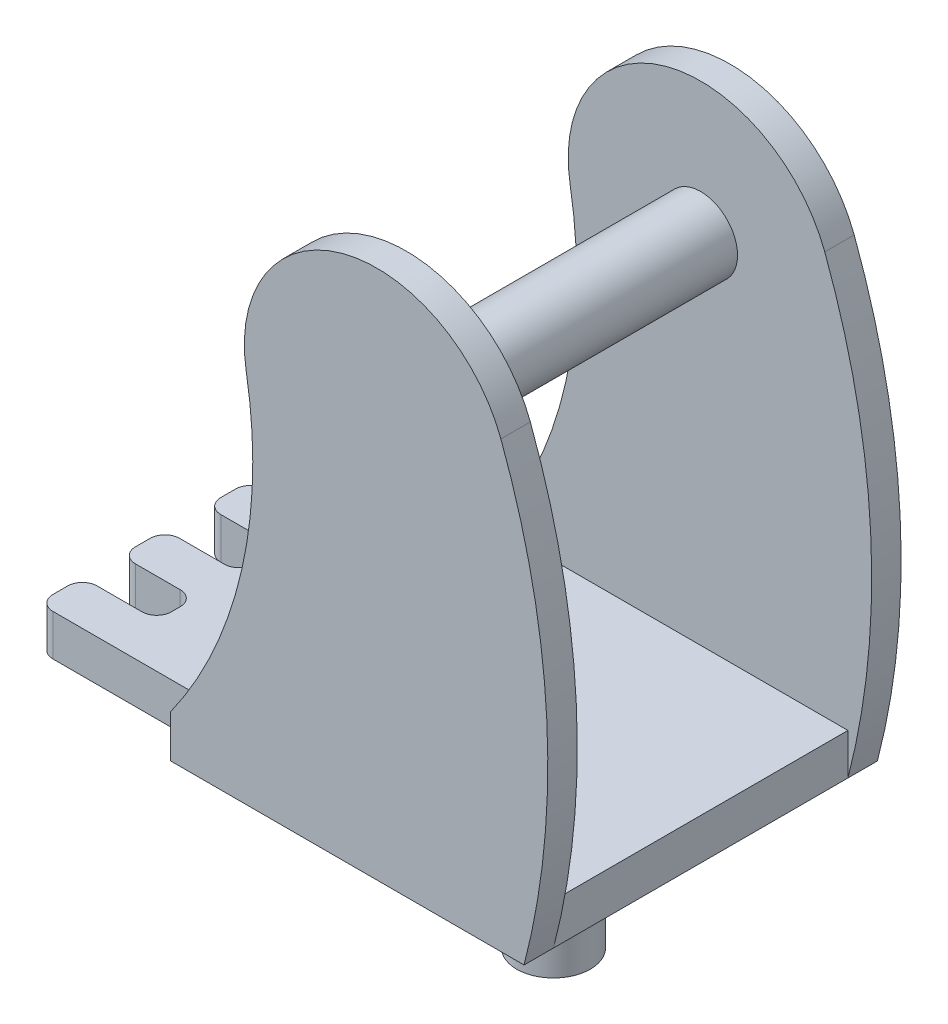
from build123d import *

# Parameters (mm, degrees)
SKETCH1_R           = 12.5
BOSS_EXTRUDE1_DEPTH = 50
BOSS_EXTRUDE2_DEPTH = 10
BOSS_EXTRUDE3_DEPTH = 14
SKETCH4_R           = 12.5
BOSS_EXTRUDE4_DEPTH = 50


with BuildPart() as part:
    # Sketch1 → Boss-Extrude1 (new, symmetric)
    with BuildSketch(Plane.XY):
        Circle(SKETCH1_R)
    extrude(amount=BOSS_EXTRUDE1_DEPTH, both=True)

    # Sketch2 → Boss-Extrude2 (add)
    with BuildSketch(Plane.XY.offset(50)):
        with BuildLine():
            Line((0, -135), (50, -135))
            ThreePointArc((50, -135), (57.725254986, -58.987850945), (42.132117825, 15.807740116))
            ThreePointArc((42.132117825, 15.807740116), (-11.798039133, 43.425871006), (-44.338945511, -7.684914504))
            ThreePointArc((-44.338945511, -7.684914504), (-45.875603416, -66.642123234), (-70, -120.459660044))
            Line((-70, -120.459660044), (-70, -135))
            Line((-70, -135), (0, -135))
        make_face()
    boss_extrude2 = extrude(amount=BOSS_EXTRUDE2_DEPTH)

    # Mirror1: Boss-Extrude2 across plane
    add(boss_extrude2.mirror(Plane.XY))

    # Sketch3 → Boss-Extrude3 (add)
    with BuildSketch(Plane(origin=(0, -135, 0), x_dir=(-1, 0, 0), z_dir=(0, -1, 0))):
        with BuildLine():
            Line((120, 7), (104.77406241, 7))
            ThreePointArc((104.77406241, 7), (101.238528504, 5.535533906), (99.77406241, 2))
            Line((99.77406241, 2), (99.77406241, -2))
            ThreePointArc((99.77406241, -2), (101.238528504, -5.535533906), (104.77406241, -7))
            Line((104.77406241, -7), (120, -7))
            ThreePointArc((120, -7), (123.535533906, -8.464466094), (125, -12))
            Line((125, -12), (125, -17))
            ThreePointArc((125, -17), (123.535533906, -20.535533906), (120, -22))
            Line((120, -22), (104.77406241, -22))
            ThreePointArc((104.77406241, -22), (101.238528504, -23.464466094), (99.77406241, -27))
            Line((99.77406241, -27), (99.77406241, -30))
            ThreePointArc((99.77406241, -30), (101.238528504, -33.535533906), (104.77406241, -35))
            Line((104.77406241, -35), (120, -35))
            ThreePointArc((120, -35), (123.535533906, -36.464466094), (125, -40))
            Line((125, -40), (125, -45))
            ThreePointArc((125, -45), (123.535533906, -48.535533906), (120, -50))
            Line((120, -50), (-50, -50))
            Line((-50, -50), (-50, 50))
            Line((-50, 50), (120, 50))
            ThreePointArc((120, 50), (123.535533906, 48.535533906), (125, 45))
            Line((125, 45), (125, 40))
            ThreePointArc((125, 40), (123.535533906, 36.464466094), (120, 35))
            Line((120, 35), (104.77406241, 35))
            ThreePointArc((104.77406241, 35), (101.238528504, 33.535533906), (99.77406241, 30))
            Line((99.77406241, 30), (99.77406241, 27))
            ThreePointArc((99.77406241, 27), (101.238528504, 23.464466094), (104.77406241, 22))
            Line((104.77406241, 22), (120, 22))
            ThreePointArc((120, 22), (123.535533906, 20.535533906), (125, 17))
            Line((125, 17), (125, 12))
            ThreePointArc((125, 12), (123.535533906, 8.464466094), (120, 7))
        make_face()
    extrude(amount=-BOSS_EXTRUDE3_DEPTH)

    # Sketch4 → Boss-Extrude4 (add)
    with BuildSketch(Plane(origin=(0, -135, 0), x_dir=(-1, 0, 0), z_dir=(0, -1, 0))):
        Circle(SKETCH4_R)
    extrude(amount=BOSS_EXTRUDE4_DEPTH)


solid = part.part
